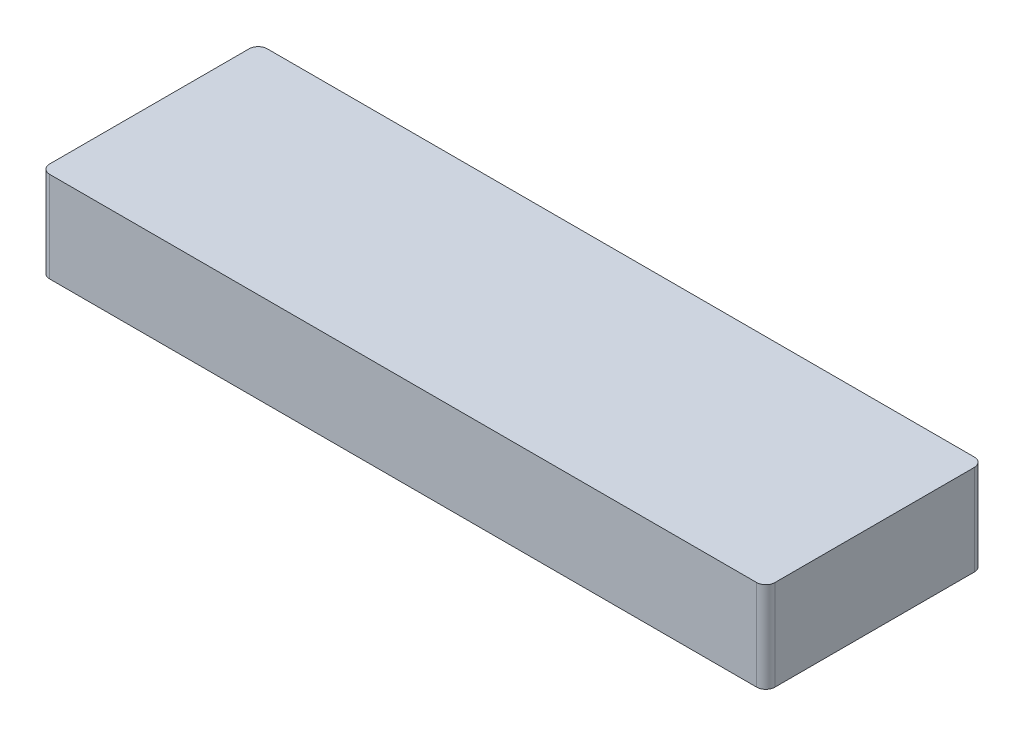
from build123d import *

# Parameters (mm, degrees)
SKETCH_1_W      = 40
SKETCH_1_H      = 12
EXTRUDE_1_DEPTH = 5
FILLET_1_R      = 0.5


with BuildPart() as part:
    # 草图1 → 凸台-拉伸1 (new body)
    with BuildSketch(Plane(origin=(0, 0, 0), x_dir=(1, 0, 0), z_dir=(0, 1, 0))):
        with Locations((20, -6)):
            Rectangle(SKETCH_1_W, SKETCH_1_H)
    extrude(amount=EXTRUDE_1_DEPTH)

    # 圆角1
    fillet_1_edges = [part.edges().sort_by_distance(p)[0] for p in [
        (0, 2.5, 0),
        (40, 2.5, 0),
        (40, 2.5, 12),
        (0, 2.5, 12),
    ]]
    fillet(fillet_1_edges, radius=FILLET_1_R)


solid = part.part
